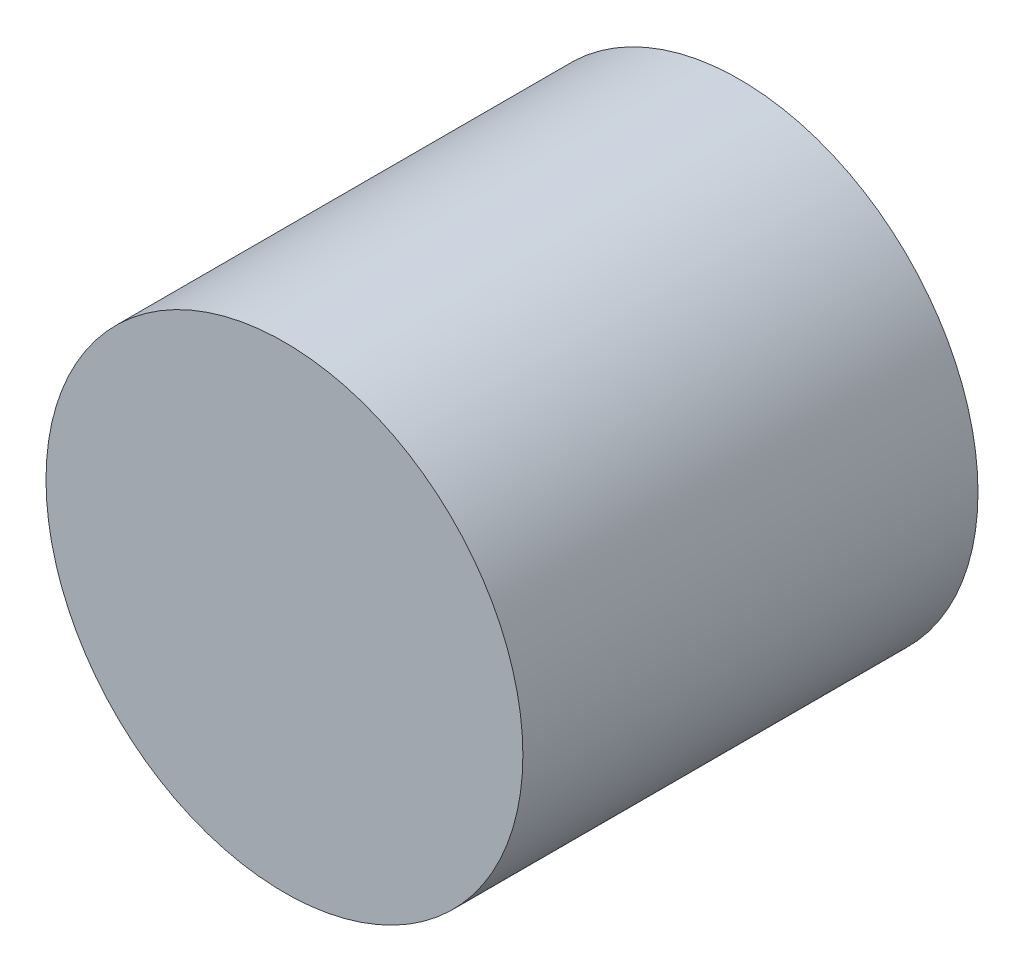
from build123d import *

# Parameters (mm, degrees)
CURVESKETCH_R   = 5.55651
CURVEBOSS_DEPTH = 10.60613


with BuildPart() as part:
    # CurveSketch → CurveBoss (new body)
    with BuildSketch(Plane.XY):
        with Locations((-3.719, 6.137)):
            Circle(CURVESKETCH_R)
    extrude(amount=CURVEBOSS_DEPTH)


solid = part.part
